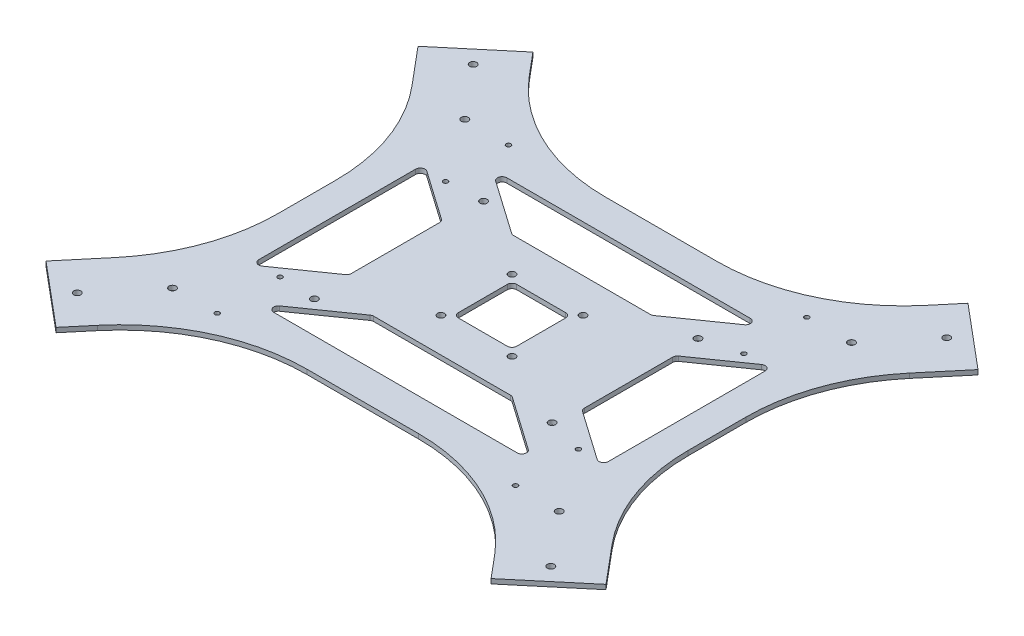
from build123d import *

# Parameters (mm, degrees)
BOSS_EXTRUDE1_DEPTH = 2
FILLET1_R           = 80
SKETCH4_R           = 1.5
CUT_EXTRUDE1_DEPTH  = 10
CUT_EXTRUDE2_DEPTH  = 10
FILLET2_R           = 2
CUT_EXTRUDE3_DEPTH  = 10
CUT_EXTRUDE4_DEPTH  = 10
SKETCH8_R           = 1
CUT_EXTRUDE5_DEPTH  = 10
SKETCH9_R           = 1.5
CUT_EXTRUDE6_DEPTH  = 10


with BuildPart() as part:
    # Sketch1 → Boss-Extrude1 (new body)
    with BuildSketch(Plane(origin=(0, 0, 0), x_dir=(1, 0, 0), z_dir=(0, 1, 0))):
        Polygon((-88, 41.502433661), (-88, -41.502433661), (-120.139380484, -79.804655817), (-93.327824975, -102.302222156), (-61.188444491, -64), (61.188444491, -64), (93.327824975, -102.302222156), (120.139380484, -79.804655817), (88, -41.502433661), (88, 41.502433661), (120.139380484, 79.804655817), (93.327824975, 102.302222156), (61.188444491, 64), (-61.188444491, 64), (-93.327824975, 102.302222156), (-120.139380484, 79.804655817), align=None)
    extrude(amount=BOSS_EXTRUDE1_DEPTH)

    # Fillet1
    fillet1_edges = [part.edges().sort_by_distance(p)[0] for p in [
        (61.188444491, 1, -64),
        (88, 1, -41.502433661),
        (88, 1, 41.502433661),
        (61.188444491, 1, 64),
        (-61.188444491, 1, 64),
        (-88, 1, 41.502433661),
        (-88, 1, -41.502433661),
        (-61.188444491, 1, -64),
    ]]
    fillet(fillet1_edges, radius=FILLET1_R)

    # Sketch4 → Cut-Extrude1 (cut)
    with BuildSketch(Plane(origin=(0, 2, 0), x_dir=(1, 0, 0), z_dir=(0, 1, 0))):
        with Locations(Location((-101.591301852, -84.925083441, 0), (0, 0, 270))):
            Circle(SKETCH4_R)
        with Locations(Location((-82.950461171, -62.709794591, 0), (0, 0, 270))):
            Circle(SKETCH4_R)
        with Locations(Location((101.591301852, -84.925083441, 0), (0, 0, 270))):
            Circle(SKETCH4_R)
        with Locations(Location((82.950461171, -62.709794591, 0), (0, 0, 270))):
            Circle(SKETCH4_R)
        with Locations(Location((101.591301852, 84.925083441, 0), (0, 0, 270))):
            Circle(SKETCH4_R)
        with Locations(Location((82.950461171, 62.709794591, 0), (0, 0, 270))):
            Circle(SKETCH4_R)
        with Locations(Location((-101.591301852, 84.925083441, 0), (0, 0, 270))):
            Circle(SKETCH4_R)
        with Locations(Location((-82.950461171, 62.709794591, 0), (0, 0, 270))):
            Circle(SKETCH4_R)
    extrude(amount=-CUT_EXTRUDE1_DEPTH, mode=Mode.SUBTRACT)

    # Sketch5 → Cut-Extrude2 (cut)
    with BuildSketch(Plane(origin=(0, 2, 0), x_dir=(1, 0, 0), z_dir=(0, 1, 0))):
        Polygon((-30, 30), (30, 30), (58.562960135, 50), (-58.562960135, 50), align=None)
        Polygon((-58.562960135, -50), (-30, -30), (30, -30), (58.562960135, -50), align=None)
        Polygon((-50, 20), (-50, -20), (-75, -37.505188455), (-75, 37.505188455), align=None)
        Polygon((75, 37.505188455), (50, 20), (50, -20), (75, -37.505188455), align=None)
    extrude(amount=-CUT_EXTRUDE2_DEPTH, mode=Mode.SUBTRACT)

    # Fillet2
    fillet2_edges = [part.edges().sort_by_distance(p)[0] for p in [
        (50, 1, -20),
        (75, 1, -37.505188455),
        (75, 1, 37.505188455),
        (50, 1, 20),
        (-30, 1, 30),
        (30, 1, 30),
        (58.562960135, 1, 50),
        (-58.562960135, 1, 50),
        (-58.562960135, 1, -50),
        (58.562960135, 1, -50),
        (30, 1, -30),
        (-30, 1, -30),
        (-75, 1, -37.505188455),
        (-50, 1, -20),
        (-50, 1, 20),
        (-75, 1, 37.505188455),
    ]]
    fillet(fillet2_edges, radius=FILLET2_R)

    # Sketch5<3> → Cut-Extrude3 (cut)
    with BuildSketch(Plane(origin=(0, 2, 0), x_dir=(1, 0, 0), z_dir=(0, 1, 0))):
        with BuildLine():
            Line((-15, -13.770980054), (-15, -15))
            Line((-15, -15), (-13.770980054, -15))
            ThreePointArc((-13.770980054, -15), (-14.189339828, -14.189339828), (-15, -13.770980054))
        make_face()
        with BuildLine():
            Line((-13.770980054, -15), (-15, -15))
            Line((-15, -15), (-15, -13.770980054))
            ThreePointArc((-15, -13.770980054), (-16.395643924, -16.218245837), (-13.75, -15.25))
            ThreePointArc((-13.75, -15.25), (-13.755254216, -15.12456061), (-13.770980054, -15))
        make_face()
        with BuildLine():
            ThreePointArc((15, -13.770980054), (14.189339828, -14.189339828), (13.770980054, -15))
            Line((13.770980054, -15), (15, -15))
            Line((15, -15), (15, -13.770980054))
        make_face()
        with BuildLine():
            Line((15, -15), (13.770980054, -15))
            ThreePointArc((13.770980054, -15), (15.12456061, -16.744745784), (16.75, -15.25))
            ThreePointArc((16.75, -15.25), (16.218245837, -14.104356076), (15, -13.770980054))
            Line((15, -13.770980054), (15, -15))
        make_face()
        with BuildLine():
            ThreePointArc((13.770980054, 15), (14.189339828, 14.189339828), (15, 13.770980054))
            Line((15, 13.770980054), (15, 15))
            Line((15, 15), (13.770980054, 15))
        make_face()
        with BuildLine():
            Line((15, 15), (15, 13.770980054))
            ThreePointArc((15, 13.770980054), (16.218245837, 14.104356076), (16.75, 15.25))
            ThreePointArc((16.75, 15.25), (15.12456061, 16.744745784), (13.770980054, 15))
            Line((13.770980054, 15), (15, 15))
        make_face()
        with BuildLine():
            ThreePointArc((-13.75, 15.25), (-16.395643924, 16.218245837), (-15, 13.770980054))
            Line((-15, 13.770980054), (-15, 15))
            Line((-15, 15), (-13.770980054, 15))
            ThreePointArc((-13.770980054, 15), (-13.755254216, 15.12456061), (-13.75, 15.25))
        make_face()
        with BuildLine():
            Line((-15, 15), (-15, 13.770980054))
            ThreePointArc((-15, 13.770980054), (-14.189339828, 14.189339828), (-13.770980054, 15))
            Line((-13.770980054, 15), (-15, 15))
        make_face()
    extrude(amount=-CUT_EXTRUDE3_DEPTH, mode=Mode.SUBTRACT)

    # Sketch6 → Cut-Extrude4 (cut)
    with BuildSketch(Plane(origin=(0, 2, 0), x_dir=(1, 0, 0), z_dir=(0, 1, 0))):
        with BuildLine():
            Line((-10.5, -12.5), (10.5, -12.5))
            ThreePointArc((10.5, -12.5), (11.914213562, -11.914213562), (12.5, -10.5))
            Line((12.5, -10.5), (12.5, 10.5))
            ThreePointArc((12.5, 10.5), (11.914213562, 11.914213562), (10.5, 12.5))
            Line((10.5, 12.5), (-10.5, 12.5))
            ThreePointArc((-10.5, 12.5), (-11.914213562, 11.914213562), (-12.5, 10.5))
            Line((-12.5, 10.5), (-12.5, -10.5))
            ThreePointArc((-12.5, -10.5), (-11.914213562, -11.914213562), (-10.5, -12.5))
        make_face()
    extrude(amount=-CUT_EXTRUDE4_DEPTH, mode=Mode.SUBTRACT)

    # Sketch8 → Cut-Extrude5 (cut)
    with BuildSketch(Plane.XZ):
        with Locations(Location((64, 35.5, 0), (0, 0, 270))):
            Circle(SKETCH8_R)
        with Locations(Location((64, 62.5, 0), (0, 0, 270))):
            Circle(SKETCH8_R)
        with Locations(Location((-64, 62.5, 0), (0, 0, 270))):
            Circle(SKETCH8_R)
        with Locations(Location((-64, 35.5, 0), (0, 0, 270))):
            Circle(SKETCH8_R)
        with Locations(Location((-64, -62.5, 0), (0, 0, 270))):
            Circle(SKETCH8_R)
        with Locations(Location((-64, -35.5, 0), (0, 0, 270))):
            Circle(SKETCH8_R)
        with Locations(Location((64, -35.5, 0), (0, 0, 270))):
            Circle(SKETCH8_R)
        with Locations(Location((64, -62.5, 0), (0, 0, 270))):
            Circle(SKETCH8_R)
    extrude(amount=-CUT_EXTRUDE5_DEPTH, mode=Mode.SUBTRACT)

    # Sketch9 → Cut-Extrude6 (cut)
    with BuildSketch(Plane(origin=(0, 2, 0), x_dir=(1, 0, 0), z_dir=(0, 1, 0))):
        with Locations(Location((48.5, 31.293024341, 0), (0, 0, 270))):
            Circle(SKETCH9_R)
        with Locations(Location((48.5, -31.293024341, 0), (0, 0, 270))):
            Circle(SKETCH9_R)
        with Locations(Location((-48.5, -36.293024341, 0), (0, 0, 270))):
            Circle(SKETCH9_R)
        with Locations(Location((-48.5, 36.293024341, 0), (0, 0, 270))):
            Circle(SKETCH9_R)
    extrude(amount=-CUT_EXTRUDE6_DEPTH, mode=Mode.SUBTRACT)


solid = part.part
